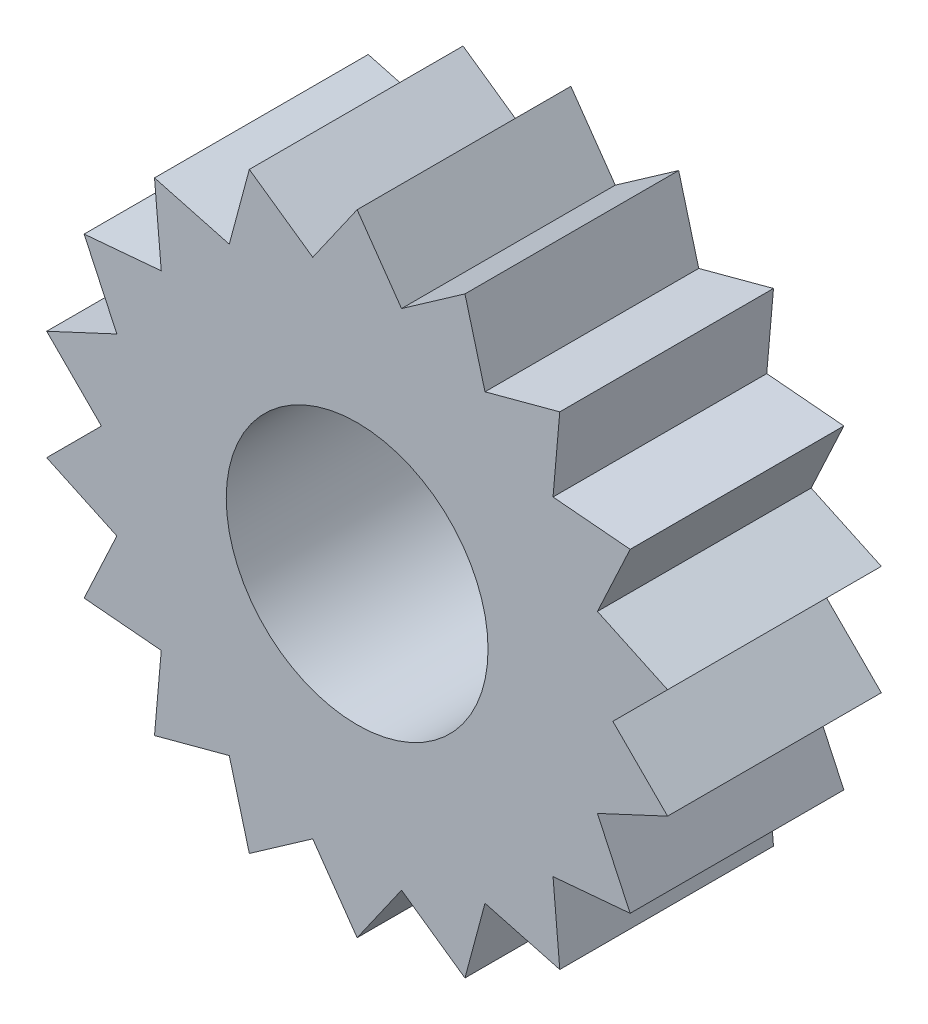
from build123d import *

# Parameters (mm, degrees)
SKIZZE1_R                       = 5.9
AUFSATZ_LINEAR_AUSTRAGEN1_DEPTH = 4
SKIZZE2_R                       = 2.45
SCHNITT_LINEAR_AUSTRAGEN1_DEPTH = 4
SKIZZE3_R                       = 6.915910243
SCHNITT_LINEAR_AUSTRAGEN3_DEPTH = 6


with BuildPart() as part:
    # Skizze1 → Aufsatz-Linear austragen1 (new body)
    with BuildSketch(Plane.XY):
        Circle(SKIZZE1_R)
    extrude(amount=AUFSATZ_LINEAR_AUSTRAGEN1_DEPTH)

    # Skizze2 → Schnitt-Linear austragen1 (cut)
    with BuildSketch(Plane(origin=(0, 0, 0), x_dir=(-1, 0, 0), z_dir=(0, 0, -1))):
        Circle(SKIZZE2_R)
    extrude(amount=-SCHNITT_LINEAR_AUSTRAGEN1_DEPTH, mode=Mode.SUBTRACT)

    # Skizze3 → Schnitt-Linear austragen3 (cut)
    with BuildSketch(Plane(origin=(0, 0, 0), x_dir=(-1, 0, 0), z_dir=(0, 0, -1))):
        Circle(SKIZZE3_R)
        Polygon((0, 5.9), (0.831052654, 4.713133809), (2.017918846, 5.544186463), (2.392920747, 4.144660313), (3.792446897, 4.519662214), (3.666167283, 3.076279615), (5.109549882, 2.95), (4.497219937, 1.636854194), (5.810365743, 1.024524248), (4.785841495, 0), (5.810365743, -1.024524248), (4.497219937, -1.636854194), (5.109549882, -2.95), (3.666167283, -3.076279615), (3.792446897, -4.519662214), (2.392920747, -4.144660313), (2.017918846, -5.544186463), (0.831052654, -4.713133809), (0, -5.9), (-0.831052654, -4.713133809), (-2.017918846, -5.544186463), (-2.392920747, -4.144660313), (-3.792446897, -4.519662214), (-3.666167283, -3.076279615), (-5.109549882, -2.95), (-4.497219937, -1.636854194), (-5.810365743, -1.024524248), (-4.785841495, 0), (-5.810365743, 1.024524248), (-4.497219937, 1.636854194), (-5.109549882, 2.95), (-3.666167283, 3.076279615), (-3.792446897, 4.519662214), (-2.392920747, 4.144660313), (-2.017918846, 5.544186463), (-0.831052654, 4.713133809), align=None, mode=Mode.SUBTRACT)
    extrude(amount=-SCHNITT_LINEAR_AUSTRAGEN3_DEPTH, mode=Mode.SUBTRACT)


solid = part.part
